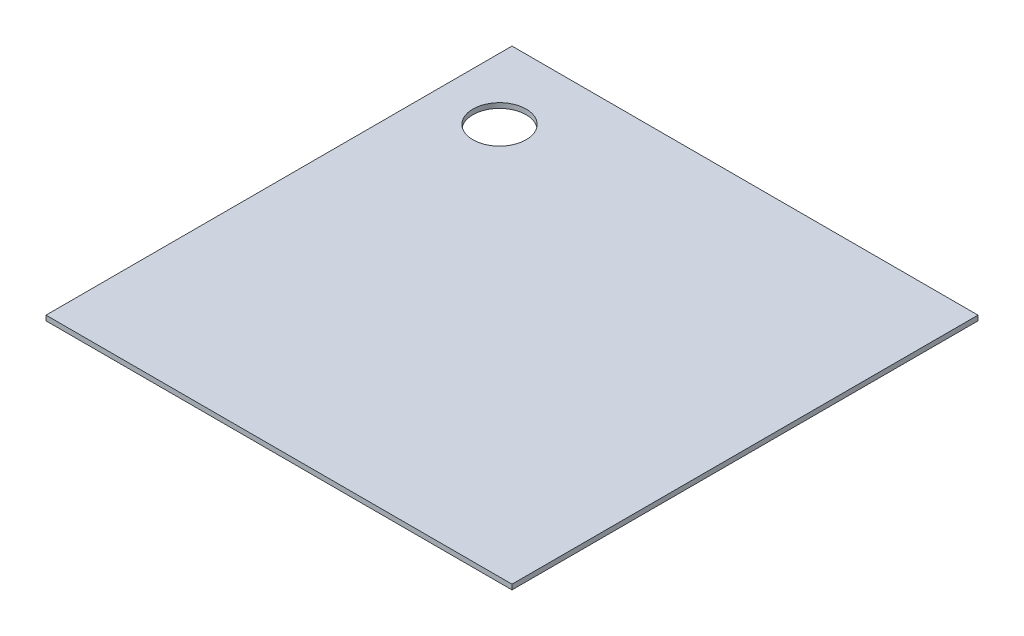
from build123d import *

# Parameters (mm, degrees)
SKETCH1_W           = 280
SKETCH1_H           = 280
SKETCH1_R           = 16
BOSS_EXTRUDE1_DEPTH = 1.5


with BuildPart() as part:
    # Sketch1 → Boss-Extrude1 (new, symmetric)
    with BuildSketch(Plane(origin=(0, 0, 0), x_dir=(1, 0, 0), z_dir=(0, 1, 0))):
        Rectangle(SKETCH1_W, SKETCH1_H)
        with Locations(Location((-103, 95.5, 0), (0, 0, 270))):
            Circle(SKETCH1_R, mode=Mode.SUBTRACT)
    extrude(amount=BOSS_EXTRUDE1_DEPTH, both=True)


solid = part.part
